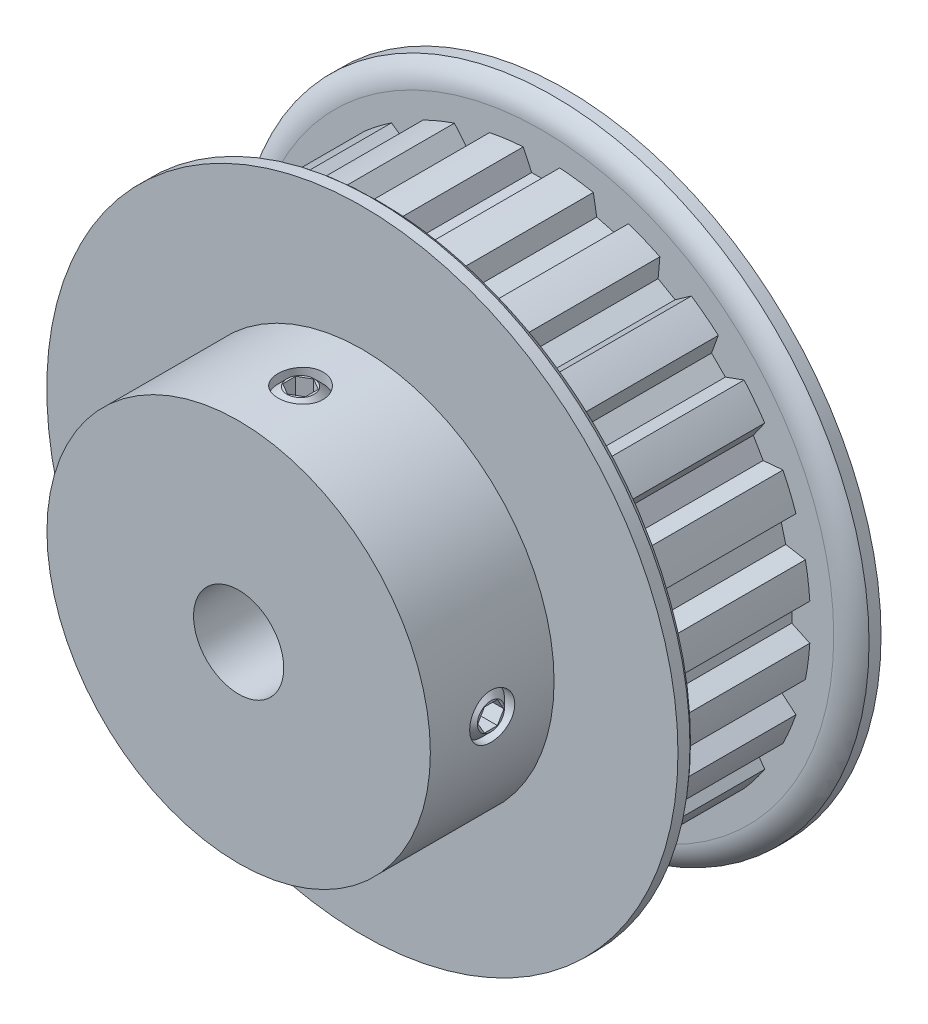
from build123d import *

# Parameters (mm, degrees)
CUT_EXTRUDE1_START = 1.1049
CUT_EXTRUDE1_DEPTH = 10.922
CIRPATTERN1_COUNT  = 24
SKETCH4_R          = 1.5875
CUT_EXTRUDE2_DEPTH = 34.470791572
CUT_EXTRUDE3_DEPTH = 1.190625
CIRPATTERN2_COUNT  = 2
CIRPATTERN2_ANGLE  = 90


with BuildPart() as part:
    # Sketch2 → Revolve1 (revolve)
    with BuildSketch(Plane(origin=(0, 0, 0), x_dir=(0, 0, -1), z_dir=(1, 0, 0)), mode=Mode.PRIVATE) as revolve1_sk:
        with BuildLine():
            Line((-11.5062, 3.175), (11.5062, 3.175))
            Line((11.5062, 3.175), (11.5062, 22.225))
            Line((11.5062, 22.225), (10.66165, 22.225))
            ThreePointArc((10.66165, 22.225), (10.040613123, 21.506254819), (9.8171, 20.583041234))
            Line((9.8171, 20.583041234), (9.8171, 18.941082468))
            Line((9.8171, 18.941082468), (-1.1049, 18.941082468))
            Line((-1.1049, 18.941082468), (-1.1049, 20.583041234))
            ThreePointArc((-1.1049, 20.583041234), (-1.328413123, 21.506254819), (-1.94945, 22.225))
            Line((-1.94945, 22.225), (-2.794, 22.225))
            Line((-2.794, 22.225), (-2.794, 13.5001))
            Line((-2.794, 13.5001), (-11.5062, 13.5001))
            Line((-11.5062, 13.5001), (-11.5062, 3.175))
        make_face()
    revolve(revolve1_sk.sketch.rotate(Axis((0, 0, 11.5062), (0, 0, -1)), 90), axis=Axis((0, 0, 11.5062), (0, 0, -1)))

    # Sketch3 → Cut-Extrude1 (cut)
    with BuildSketch(Plane.XY.offset(CUT_EXTRUDE1_START)):
        with BuildLine():
            Line((-0.690489274, 17.6276), (0.690489274, 17.6276))
            Line((0.690489274, 17.6276), (1.2827, 18.8976))
            ThreePointArc((1.2827, 18.8976), (0, 18.941082468), (-1.2827, 18.8976))
            Line((-1.2827, 18.8976), (-0.690489274, 17.6276))
        make_face()
    cut_extrude1 = extrude(amount=-CUT_EXTRUDE1_DEPTH, mode=Mode.SUBTRACT)

    # CirPattern1: Cut-Extrude1 ×24 about axis
    cirpattern1_axis = Axis((0, 0, 0), (0, 0, 1))
    for i in range(1, CIRPATTERN1_COUNT):
        add(cut_extrude1.rotate(cirpattern1_axis, i * 360 / CIRPATTERN1_COUNT), mode=Mode.SUBTRACT)

    # Sketch4 → Cut-Extrude2 (cut, through all)
    with BuildSketch(Plane(origin=(0, 0, 0), x_dir=(1, 0, 0), z_dir=(0, 1, 0))):
        with Locations(Location((0, -7.1501, 0), (0, 0, 90))):
            Circle(SKETCH4_R)
    cut_extrude2 = extrude(amount=CUT_EXTRUDE2_DEPTH, mode=Mode.SUBTRACT)

    # Sketch5 → Revolve2 (revolve)
    with BuildSketch(Plane.XY.offset(7.1501), mode=Mode.PRIVATE) as revolve2_sk:
        Polygon((0, 13.406436654), (0, 3.175), (-0.9525, 3.175), (-1.5875, 3.81), (-1.5875, 12.771436654), (-0.9525, 13.406436654), align=None)
    revolve2 = revolve(revolve2_sk.sketch.rotate(Axis((0, 0, 7.1501), (0, 1, 0)), 270), axis=Axis((0, 0, 7.1501), (0, 1, 0)))

    # Sketch6 → Cut-Extrude3 (cut)
    with BuildSketch(Plane(origin=(0, 13.406436654, 0), x_dir=(-1, 0, 0), z_dir=(0, -1, 0))):
        Polygon((0, -6.233556448), (-0.79375, -6.691828224), (-0.79375, -7.608371776), (0, -8.066643552), (0.79375, -7.608371776), (0.79375, -6.691828224), align=None)
    cut_extrude3 = extrude(amount=CUT_EXTRUDE3_DEPTH, mode=Mode.SUBTRACT)

    # CirPattern2: Cut-Extrude2, Revolve2, Cut-Extrude3 ×2 about axis
    cirpattern2_axis = Axis((0, 0, 0), (0, 0, -1))
    add([cut_extrude2.rotate(cirpattern2_axis, i * CIRPATTERN2_ANGLE / (CIRPATTERN2_COUNT - 1)) for i in range(1, CIRPATTERN2_COUNT)], mode=Mode.SUBTRACT)
    add([revolve2.rotate(cirpattern2_axis, i * CIRPATTERN2_ANGLE / (CIRPATTERN2_COUNT - 1)) for i in range(1, CIRPATTERN2_COUNT)])
    add([cut_extrude3.rotate(cirpattern2_axis, i * CIRPATTERN2_ANGLE / (CIRPATTERN2_COUNT - 1)) for i in range(1, CIRPATTERN2_COUNT)], mode=Mode.SUBTRACT)


solid = part.part
